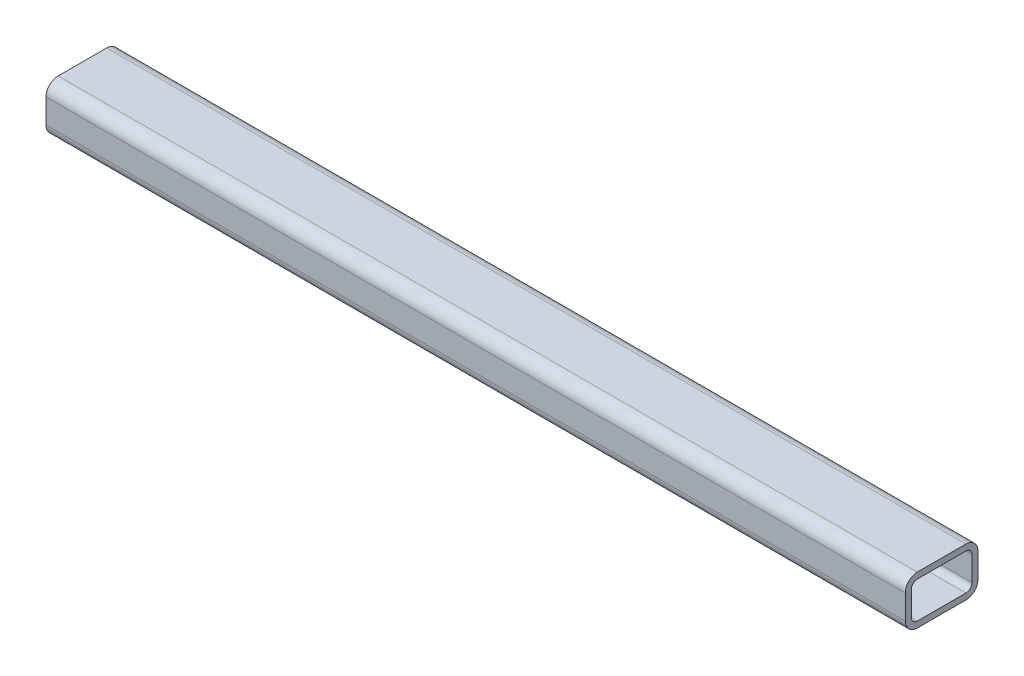
from build123d import *

# Parameters (mm, degrees)
TUBO_RECTANGULAR_3_X_2_X_0_25_1_DEPTH = 900


with BuildPart() as part:
    # Sketch1 → Tubo rectangular 3 X 2 X 0.25(1) (new body)
    with BuildSketch(Plane.YZ):
        with BuildLine():
            Line((-12.699978, -38.1), (12.699978, -38.1))
            ThreePointArc((12.699978, -38.1), (21.680234121, -34.380256121), (25.399978, -25.4))
            Line((25.399978, -25.4), (25.399978, 25.4))
            ThreePointArc((25.399978, 25.4), (21.680234121, 34.380256121), (12.699978, 38.1))
            Line((12.699978, 38.1), (-12.699978, 38.1))
            ThreePointArc((-12.699978, 38.1), (-21.680234121, 34.380256121), (-25.399978, 25.4))
            Line((-25.399978, 25.4), (-25.399978, -25.4))
            ThreePointArc((-25.399978, -25.4), (-21.680234121, -34.380256121), (-12.699978, -38.1))
        make_face()
        with BuildLine():
            Line((-12.699978, -31.75), (12.699978, -31.75))
            ThreePointArc((12.699978, -31.75), (17.190106061, -29.890128061), (19.049978, -25.4))
            Line((19.049978, -25.4), (19.049978, 25.4))
            ThreePointArc((19.049978, 25.4), (17.190106061, 29.890128061), (12.699978, 31.75))
            Line((12.699978, 31.75), (-12.699978, 31.75))
            ThreePointArc((-12.699978, 31.75), (-17.190106061, 29.890128061), (-19.049978, 25.4))
            Line((-19.049978, 25.4), (-19.049978, -25.4))
            ThreePointArc((-19.049978, -25.4), (-17.190106061, -29.890128061), (-12.699978, -31.75))
        make_face(mode=Mode.SUBTRACT)
    extrude(amount=TUBO_RECTANGULAR_3_X_2_X_0_25_1_DEPTH)


solid = part.part
